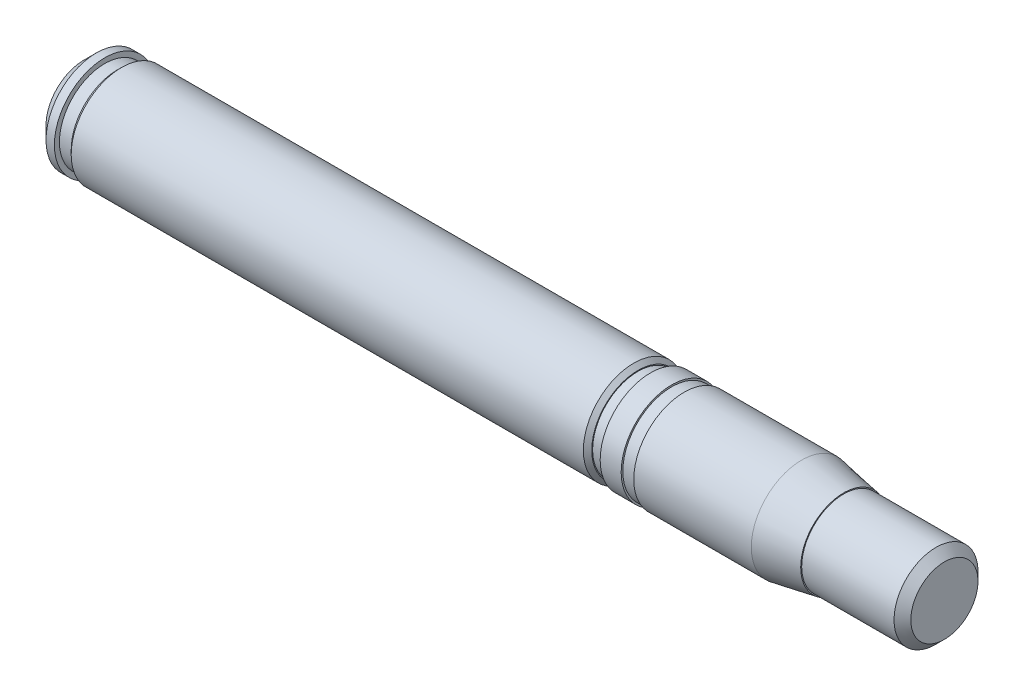
from build123d import *

# Parameters (mm, degrees)
CHANFREIN1_SIZE = 1
CHANFREIN2_SIZE = 1.5
CHANFREIN3_SIZE = 0.5


with BuildPart() as part:
    # Esquisse1 → Révolution1 (revolve)
    with BuildSketch(Plane.XY, mode=Mode.PRIVATE) as r_volution1_sk:
        Polygon((-64.788489135, 0), (-64.788489135, 6), (-62.288489135, 6), (-62.288489135, 5.4), (-60.788489135, 5.4), (-60.788489135, 6), (1.211510865, 6), (1.211510865, 5.4), (2.711510865, 5.4), (2.711510865, 6), (5.211510865, 6), (5.211510865, 5.8), (6.711510865, 5.8), (6.711510865, 6), (20.711510865, 6), (25.711510865, 5.118365096), (25.711510865, 5), (37.711510865, 5), (37.711510865, 0), align=None)
    revolve(r_volution1_sk.sketch.rotate(Axis((-77.674282493, 0, 0), (1, 0, 0)), 90), axis=Axis((-77.674282493, 0, 0), (1, 0, 0)))

    # Chanfrein1
    chanfrein1_edges = [part.edges().sort_by_distance(p)[0] for p in [
        (37.711510865, 0, -5),
    ]]
    chamfer(chanfrein1_edges, length=CHANFREIN1_SIZE)

    # Chanfrein2
    chanfrein2_edges = [part.edges().sort_by_distance(p)[0] for p in [
        (-64.788489135, 0, -6),
    ]]
    chamfer(chanfrein2_edges, length=CHANFREIN2_SIZE)

    # Chanfrein3
    chanfrein3_edges = [part.edges().sort_by_distance(p)[0] for p in [
        (1.211510865, 0, -6),
        (-60.788489135, 0, -6),
    ]]
    chamfer(chanfrein3_edges, length=CHANFREIN3_SIZE)


solid = part.part
